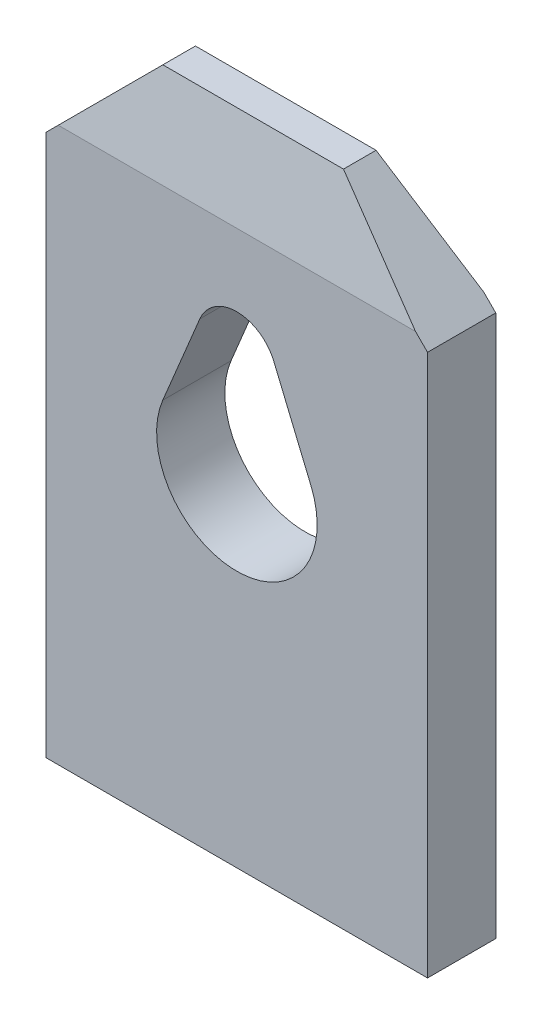
from build123d import *

# Parameters (mm, degrees)
BOSS_EXTRUDE1_DEPTH = 4.75
CUT_EXTRUDE1_REACH  = 11.471
CUT_EXTRUDE2_DEPTH  = 0.85


with BuildPart() as part:
    # Sketch1 → Boss-Extrude1 (new body)
    with BuildSketch(Plane(origin=(0, 0, 0), x_dir=(0, 0, -1), z_dir=(1, 0, 0))):
        Polygon((0, 0.15), (0, 7.05), (-0.241393443, 8.15), (-0.647131148, 8.15), (-0.85, 7.05), (-0.85, 0.15), align=None)
    extrude(amount=BOSS_EXTRUDE1_DEPTH)

    # Cut-Extrude1: up to this face of the body (flat: up to its plane)
    cut_extrude1_end = Plane(part.part.faces().sort_by_distance((2.375, 3.6, 0))[0])
    # Sketch4 → Cut-Extrude1 (cut, up to the picked face)
    with BuildSketch(Plane.XY.offset(0.85), mode=Mode.PRIVATE) as cut_extrude1_sk1:
        Polygon((0, 6.9), (1.25, 8.15), (0, 8.15), align=None)
    cut_extrude1_tool1 = split(extrude(cut_extrude1_sk1.sketch, amount=-CUT_EXTRUDE1_REACH, mode=Mode.PRIVATE), bisect_by=cut_extrude1_end, keep=Keep.BOTH, mode=Mode.PRIVATE)
    # Sketch4 → Cut-Extrude1 (cut, up to the picked face)
    with BuildSketch(Plane.XY.offset(0.85), mode=Mode.PRIVATE) as cut_extrude1_sk2:
        Polygon((3.5, 8.15), (4.75, 6.9), (4.75, 8.15), align=None)
    cut_extrude1_tool2 = split(extrude(cut_extrude1_sk2.sketch, amount=-CUT_EXTRUDE1_REACH, mode=Mode.PRIVATE), bisect_by=cut_extrude1_end, keep=Keep.BOTH, mode=Mode.PRIVATE)
    add(cut_extrude1_tool1.solids().sort_by(Axis((0.416667, 7.733333, 0.85), (0, 0, -1)))[0], mode=Mode.SUBTRACT)
    add(cut_extrude1_tool2.solids().sort_by(Axis((4.333333, 7.733333, 0.85), (0, 0, -1)))[0], mode=Mode.SUBTRACT)

    # Sketch5 → Cut-Extrude2 (cut)
    with BuildSketch(Plane.XY.offset(0.85)):
        with BuildLine():
            Line((1.913461538, 5.842307692), (1.451923077, 4.734615385))
            ThreePointArc((1.451923077, 4.734615385), (2.37510742, 3.350000006), (3.297994271, 4.734813689))
            Line((3.297994271, 4.734813689), (2.842436975, 5.827489929))
            ThreePointArc((2.842436975, 5.827489929), (2.382974312, 6.149936406), (1.913461538, 5.842307692))
        make_face()
    extrude(amount=-CUT_EXTRUDE2_DEPTH, mode=Mode.SUBTRACT)


solid = part.part
